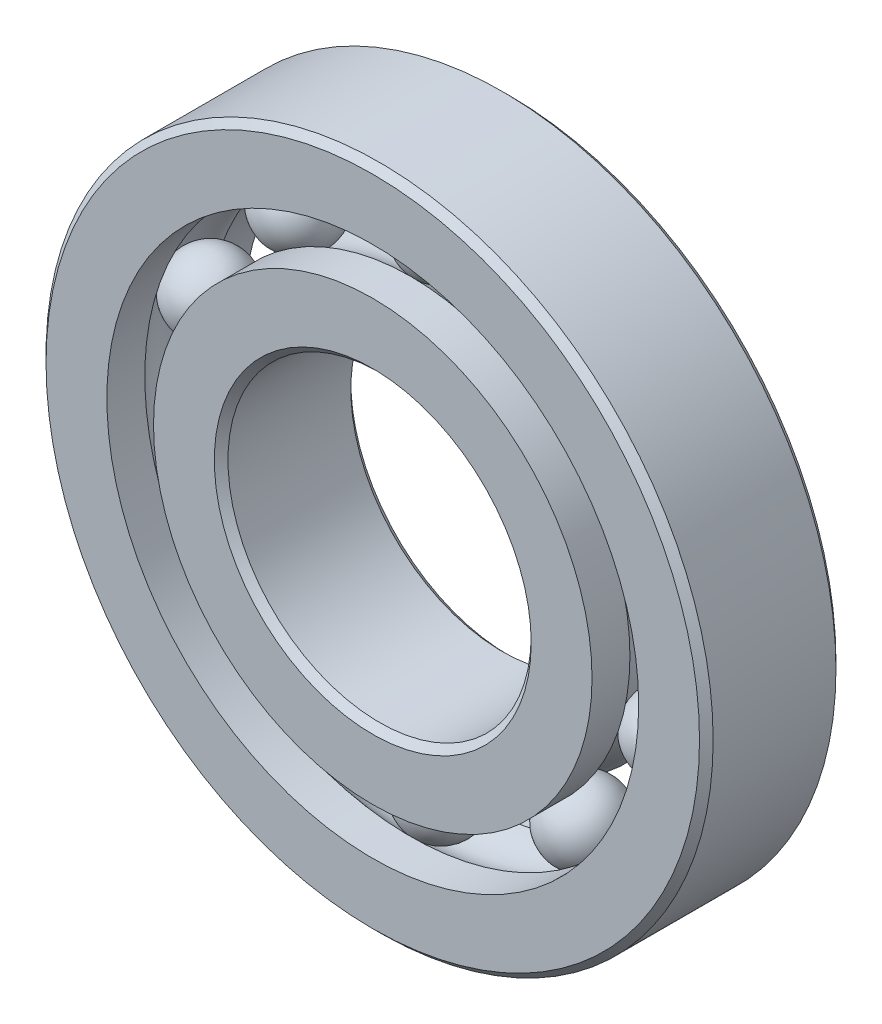
from build123d import *

# Parameters (mm, degrees)
CIRPATTERN1_COUNT = 10


with BuildPart() as part:
    # Sketch1 → Revolve1 (revolve)
    with BuildSketch(Plane(origin=(0, 0, 0), x_dir=(0, 0, -1), z_dir=(1, 0, 0))):
        with BuildLine():
            Line((3.2146875, 17.4625), (-3.2146875, 17.4625))
            Line((-3.2146875, 17.4625), (-3.571875, 17.1053125))
            Line((-3.571875, 17.1053125), (-3.571875, 13.921153846))
            Line((-3.571875, 13.921153846), (-1.5875, 13.921153846))
            ThreePointArc((-1.5875, 13.921153846), (0, 14.702841223), (1.5875, 13.921153846))
            Line((1.5875, 13.921153846), (3.571875, 13.921153846))
            Line((3.571875, 13.921153846), (3.571875, 17.1053125))
            Line((3.571875, 17.1053125), (3.2146875, 17.4625))
        make_face()
    revolve(axis=Axis((0, 0, 3.571875), (0, 0, -1)))


with BuildPart() as body_2:
    # Sketch3 → Revolve3 (revolve)
    with BuildSketch(Plane(origin=(0, 0, 0), x_dir=(0, 0, -1), z_dir=(1, 0, 0))):
        with BuildLine():
            Line((-3.571875, 11.478846154), (-1.5875, 11.478846154))
            ThreePointArc((-1.5875, 11.478846154), (0, 10.697158777), (1.5875, 11.478846154))
            Line((1.5875, 11.478846154), (3.571875, 11.478846154))
            Line((3.571875, 11.478846154), (3.571875, 8.2946875))
            Line((3.571875, 8.2946875), (3.2146875, 7.9375))
            Line((3.2146875, 7.9375), (-3.2146875, 7.9375))
            Line((-3.2146875, 7.9375), (-3.571875, 8.2946875))
            Line((-3.571875, 8.2946875), (-3.571875, 11.478846154))
        make_face()
    revolve(axis=Axis((0, 0, 3.571875), (0, 0, -1)))


with BuildPart() as body_3:
    # Sketch4 → Revolve4 (revolve)
    with BuildSketch(Plane(origin=(0, 0, 0), x_dir=(0, 0, -1), z_dir=(1, 0, 0))):
        with BuildLine():
            Line((-2.002841223, 12.7), (2.002841223, 12.7))
            ThreePointArc((2.002841223, 12.7), (0, 14.702841223), (-2.002841223, 12.7))
        make_face()
    revolve(axis=Axis((0, 12.7, 2.002841223), (0, 0, -1)))


with BuildPart() as cirpattern1_1:
    # CirPattern1: pattern copy
    add(body_3.part.rotate(Axis((0, 0, -3.571875), (0, 0, 1)), 1 * 360 / CIRPATTERN1_COUNT))


with BuildPart() as cirpattern1_2:
    # CirPattern1: pattern copy
    add(body_3.part.rotate(Axis((0, 0, -3.571875), (0, 0, 1)), 2 * 360 / CIRPATTERN1_COUNT))


with BuildPart() as cirpattern1_3:
    # CirPattern1: pattern copy
    add(body_3.part.rotate(Axis((0, 0, -3.571875), (0, 0, 1)), 3 * 360 / CIRPATTERN1_COUNT))


with BuildPart() as cirpattern1_4:
    # CirPattern1: pattern copy
    add(body_3.part.rotate(Axis((0, 0, -3.571875), (0, 0, 1)), 4 * 360 / CIRPATTERN1_COUNT))


with BuildPart() as cirpattern1_5:
    # CirPattern1: pattern copy
    add(body_3.part.rotate(Axis((0, 0, -3.571875), (0, 0, 1)), 5 * 360 / CIRPATTERN1_COUNT))


with BuildPart() as cirpattern1_6:
    # CirPattern1: pattern copy
    add(body_3.part.rotate(Axis((0, 0, -3.571875), (0, 0, 1)), 6 * 360 / CIRPATTERN1_COUNT))


with BuildPart() as cirpattern1_7:
    # CirPattern1: pattern copy
    add(body_3.part.rotate(Axis((0, 0, -3.571875), (0, 0, 1)), 7 * 360 / CIRPATTERN1_COUNT))


with BuildPart() as cirpattern1_8:
    # CirPattern1: pattern copy
    add(body_3.part.rotate(Axis((0, 0, -3.571875), (0, 0, 1)), 8 * 360 / CIRPATTERN1_COUNT))


with BuildPart() as cirpattern1_9:
    # CirPattern1: pattern copy
    add(body_3.part.rotate(Axis((0, 0, -3.571875), (0, 0, 1)), 9 * 360 / CIRPATTERN1_COUNT))


solid = Compound([part.part, body_2.part, body_3.part, cirpattern1_1.part, cirpattern1_2.part, cirpattern1_3.part, cirpattern1_4.part, cirpattern1_5.part, cirpattern1_6.part, cirpattern1_7.part, cirpattern1_8.part, cirpattern1_9.part])
